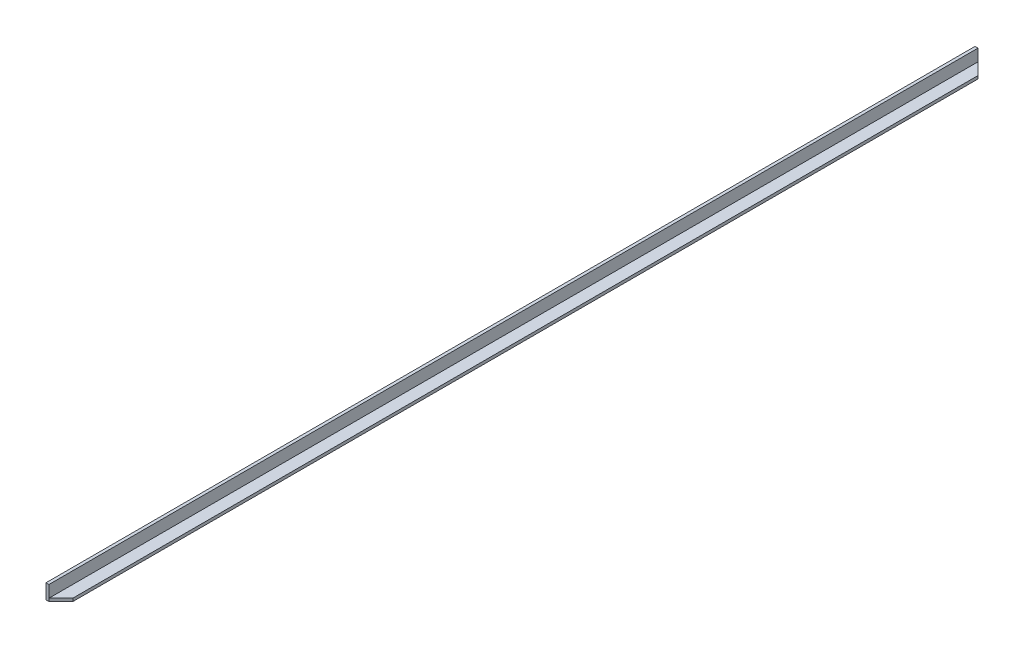
from build123d import *

# Parameters (mm, degrees)
EXTRUDE_1_DEPTH     = 1250
CUT_EXTRUDE_1_DEPTH = 1251.14239189
CUT_EXTRUDE_2_DEPTH = 1251.14239189


with BuildPart() as part:
    # Эскиз1 → Бобышка-Вытянуть1 (new body)
    with BuildSketch(Plane.XY):
        Polygon((-10, 0), (10, 0), (10, 4), (-6, 4), (-6, 20), (-10, 20), align=None)
    extrude(amount=EXTRUDE_1_DEPTH)

    # Эскиз2 → Вырез-Вытянуть1 (cut, through all)
    with BuildSketch(Plane(origin=(0, 4, 0), x_dir=(1, 0, 0), z_dir=(0, 1, 0))):
        Polygon((-6, 0), (10, -16), (10, 0), align=None)
    extrude(amount=-CUT_EXTRUDE_1_DEPTH, mode=Mode.SUBTRACT)

    # Эскиз3 → Вырез-Вытянуть2 (cut, through all)
    with BuildSketch(Plane(origin=(0, 4, 0), x_dir=(1, 0, 0), z_dir=(0, 1, 0))):
        Polygon((-6, -1250), (10, -1234), (10, -1250), align=None)
    extrude(amount=-CUT_EXTRUDE_2_DEPTH, mode=Mode.SUBTRACT)


solid = part.part
